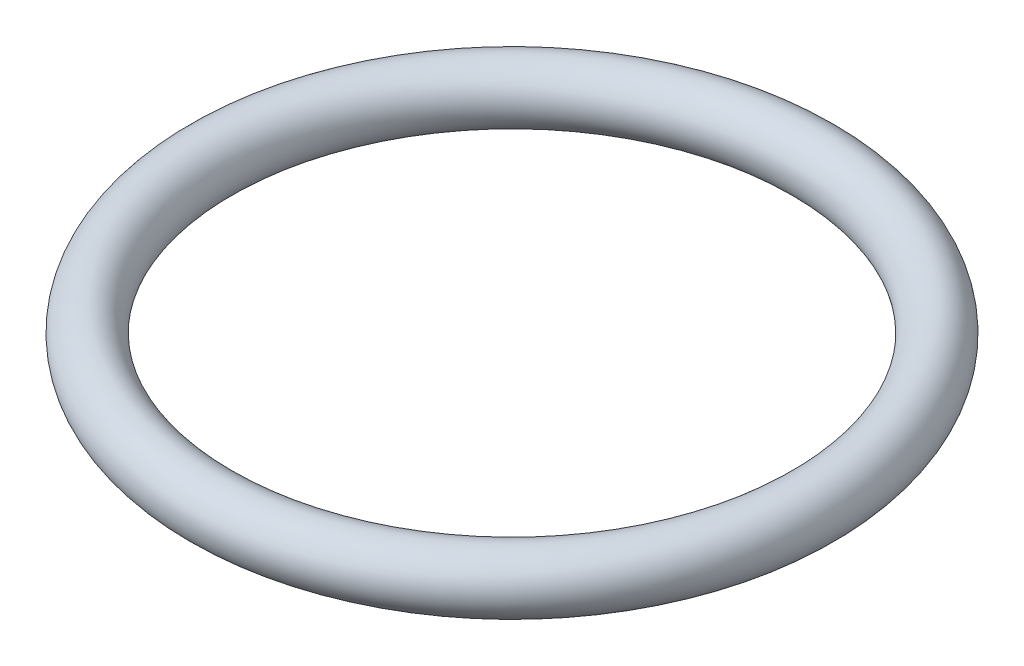
from build123d import *

# Parameters (mm, degrees)
IZIM1_R = 1.765


with BuildPart() as part:
    # Çizim1 → Döndür1 (revolve)
    with BuildSketch(Plane.XY, mode=Mode.PRIVATE) as d_nd_r1_sk:
        with Locations((-18.225, 0)):
            Circle(IZIM1_R)
    revolve(d_nd_r1_sk.sketch.rotate(Axis((0, 0, 0), (0, -1, 0)), 270), axis=Axis((0, 0, 0), (0, -1, 0)))


solid = part.part
